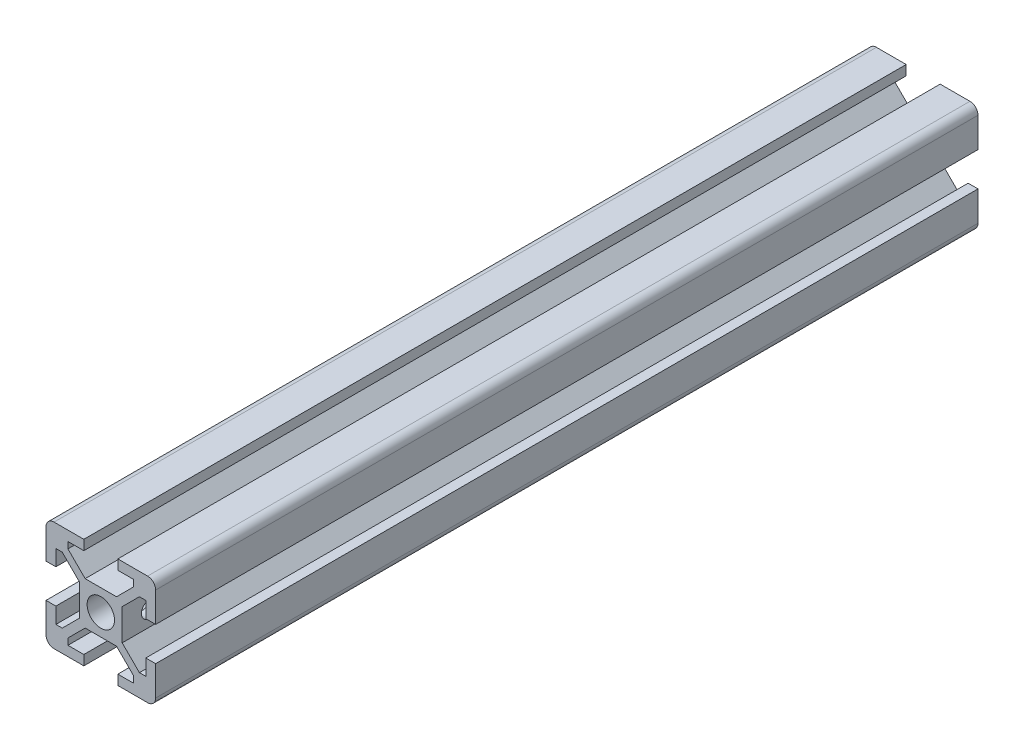
from build123d import *

# Parameters (mm, degrees)
SKETCH1_R           = 2.5
BOSS_EXTRUDE1_DEPTH = 150
FILLET1_R           = 1.47
SKETCH2_R           = 1.5
CUT_EXTRUDE1_DEPTH  = 151.974203094
SKETCH3_R           = 1.5
CUT_EXTRUDE2_DEPTH  = 151.974203194


with BuildPart() as part:
    # Sketch1 → Boss-Extrude1 (new body)
    with BuildSketch(Plane.XY):
        Polygon((2.860553032, 3.9), (6, 7.039446968), (6, 8.2), (3.1, 8.2), (3.1, 10), (10, 10), (10, 3.1), (8.2, 3.1), (8.2, 6), (7.039446968, 6), (3.9, 2.860553032), (3.9, 0), (3.9, -2.860553032), (7.039446968, -6), (8.2, -6), (8.2, -3.1), (10, -3.1), (10, -10), (3.1, -10), (3.1, -8.2), (6, -8.2), (6, -7.039446968), (2.860553032, -3.9), (0, -3.9), (-2.860553032, -3.9), (-6, -7.039446968), (-6, -8.2), (-3.1, -8.2), (-3.1, -10), (-10, -10), (-10, -3.1), (-8.2, -3.1), (-8.2, -6), (-7.039446968, -6), (-3.9, -2.860553032), (-3.9, 0), (-3.9, 2.860553032), (-7.039446968, 6), (-8.2, 6), (-8.2, 3.1), (-10, 3.1), (-10, 10), (-3.1, 10), (-3.1, 8.2), (-6, 8.2), (-6, 7.039446968), (-2.860553032, 3.9), (0, 3.9), align=None)
        Circle(SKETCH1_R, mode=Mode.SUBTRACT)
    extrude(amount=BOSS_EXTRUDE1_DEPTH)

    # Fillet1
    fillet1_edges = [part.edges().sort_by_distance(p)[0] for p in [
        (10, -10, 75),
        (-10, -10, 75),
        (-10, 10, 75),
        (10, 10, 75),
    ]]
    fillet(fillet1_edges, radius=FILLET1_R)

    # Sketch2 → Cut-Extrude1 (cut, through all)
    with BuildSketch(Plane.ZY.offset(3.9)):
        with Locations(Location((145, 0, 0), (0, 0, 270))):
            Circle(SKETCH2_R)
        with Locations(Location((135, 0, 0), (0, 0, 270))):
            Circle(SKETCH2_R)
        with Locations(Location((125, 0, 0), (0, 0, 270))):
            Circle(SKETCH2_R)
        with Locations(Location((30, 0, 0), (0, 0, 270))):
            Circle(SKETCH2_R)
    extrude(amount=-CUT_EXTRUDE1_DEPTH, mode=Mode.SUBTRACT)

    # Sketch3 → Cut-Extrude2 (cut, through all)
    with BuildSketch(Plane(origin=(0, 3.9, 0), x_dir=(1, 0, 0), z_dir=(0, 1, 0))):
        with Locations(Location((0, -30, 0), (0, 0, 180))):
            Circle(SKETCH3_R)
    extrude(amount=-CUT_EXTRUDE2_DEPTH, mode=Mode.SUBTRACT)


solid = part.part
